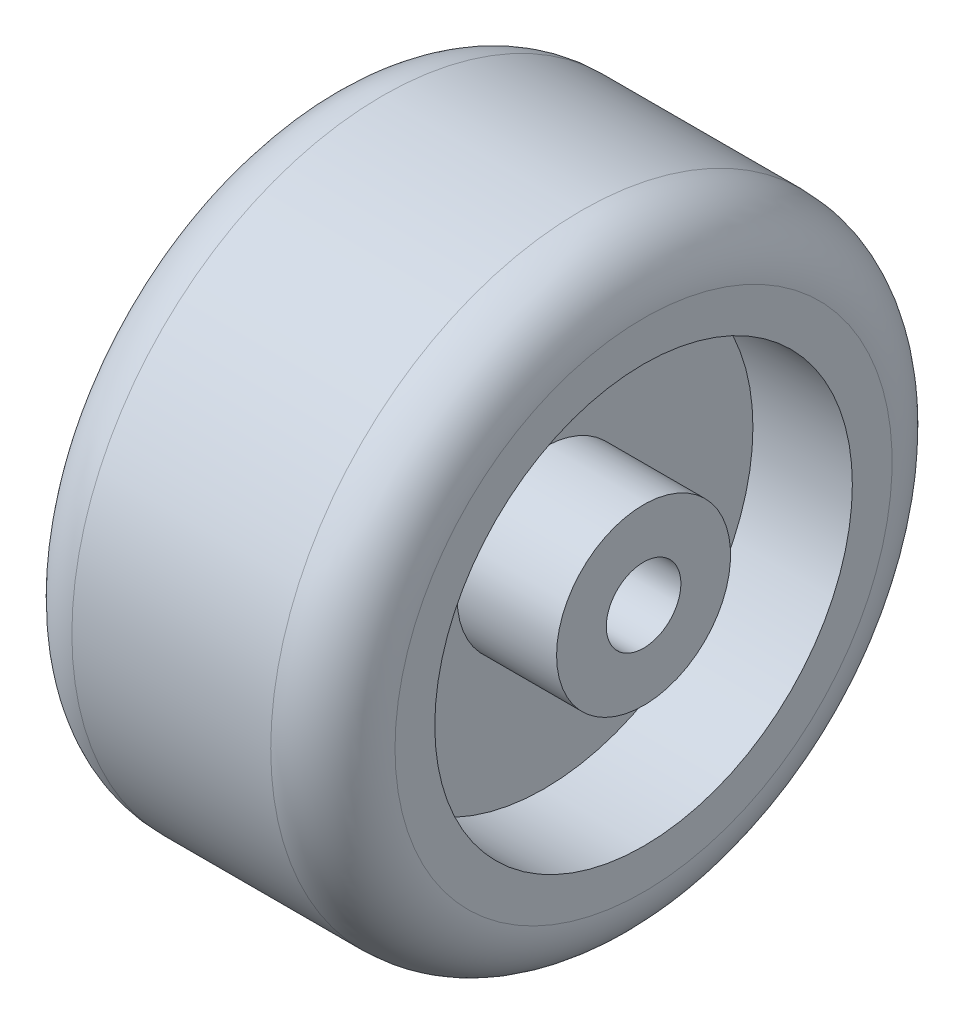
from build123d import *


with BuildPart() as part:
    # Sketch1 → Revolve1 (revolve)
    with BuildSketch(Plane.XY, mode=Mode.PRIVATE) as revolve1_sk:
        with BuildLine():
            Line((0, 1.5), (0, 3.5))
            Line((0, 3.5), (-4, 3.5))
            Line((-4, 3.5), (-4, 8.4))
            Line((-4, 8.4), (0, 8.4))
            Line((0, 8.4), (0, 10))
            ThreePointArc((0, 10), (-0.732233047, 11.767766953), (-2.5, 12.5))
            Line((-2.5, 12.5), (-10.5, 12.5))
            ThreePointArc((-10.5, 12.5), (-12.267766953, 11.767766953), (-13, 10))
            Line((-13, 10), (-13, 8.4))
            Line((-13, 8.4), (-9, 8.4))
            Line((-9, 8.4), (-9, 3.5))
            Line((-9, 3.5), (-13, 3.5))
            Line((-13, 3.5), (-13, 1.5))
            Line((-13, 1.5), (0, 1.5))
        make_face()
    revolve(revolve1_sk.sketch.rotate(Axis((-1000.574907176, 0, 0), (1, 0, 0)), 90), axis=Axis((-1000.574907176, 0, 0), (1, 0, 0)))


solid = part.part
